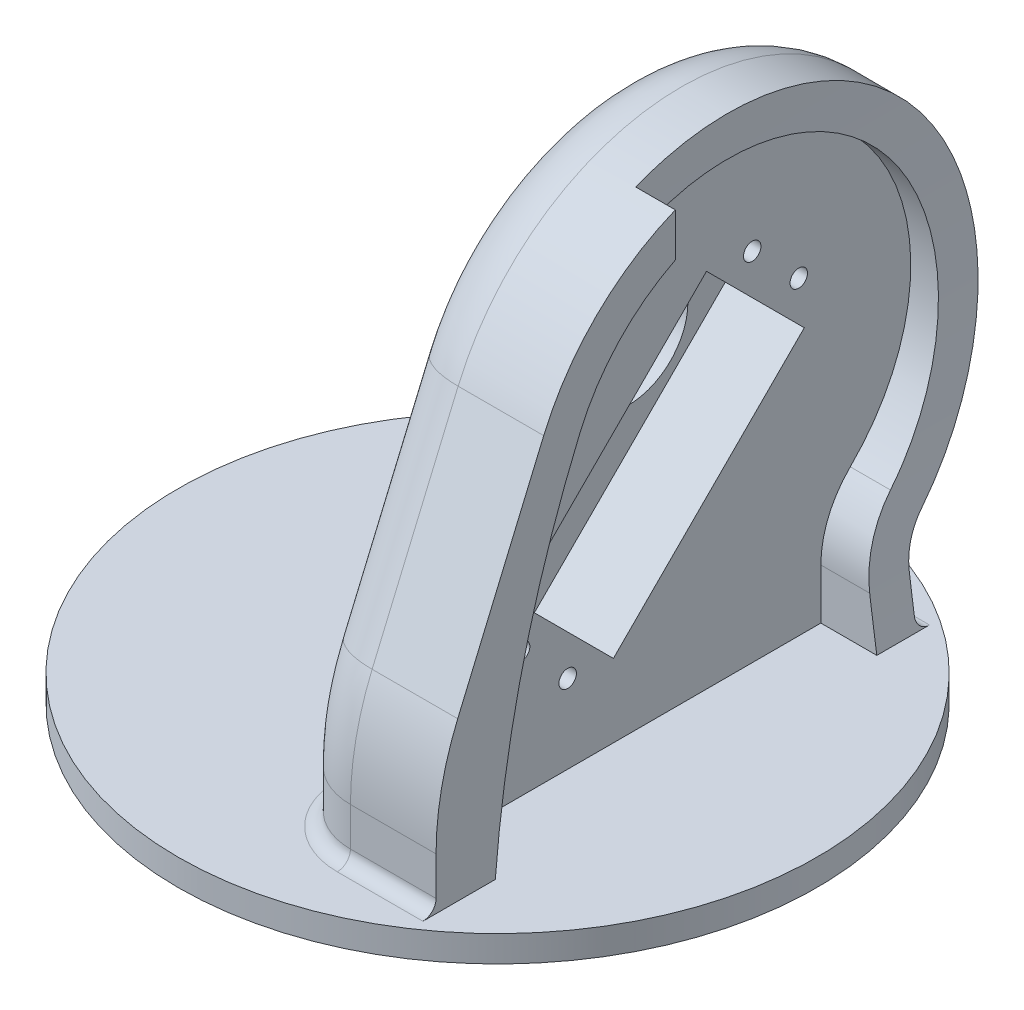
from build123d import *

# Parameters (mm, degrees)
SKETCH2_R                       = 48.5
SKETCH2_R_2                     = 1.5
BOSS_EXTRUDE1_DEPTH             = 4
SKETCH3_R                       = 3.75
CUT_EXTRUDE1_DEPTH              = 1.5
BOSS_EXTRUDE2_START             = 4
SKETCH4_R                       = 9
BOSS_EXTRUDE2_DEPTH             = 14
CUT_EXTRUDE2_START              = 6
SKETCH6_R                       = 1.325
CUT_EXTRUDE2_DEPTH              = 93.806192047
BOSS_EXTRUDE3_DEPTH             = 9
BOSS_EXTRUDE3_DIRECTION_2_REACH = 110.778
CUT_EXTRUDE3_DEPTH              = 105.285680763
FILLET1_R                       = 10
FILLET2_R                       = 2


with BuildPart() as part:
    # Sketch2 → Boss-Extrude1 (new body)
    with BuildSketch(Plane(origin=(0, 0, 0), x_dir=(1, 0, 0), z_dir=(0, 1, 0))):
        with Locations(Location((0, 0, 0), (0, 0, 270))):
            Circle(SKETCH2_R)
        with Locations(Location((0, 7.25, 0), (0, 0, 270))):
            Circle(SKETCH2_R_2, mode=Mode.SUBTRACT)
        with Locations(Location((0, -7.25, 0), (0, 0, 270))):
            Circle(SKETCH2_R_2, mode=Mode.SUBTRACT)
    extrude(amount=-BOSS_EXTRUDE1_DEPTH)

    # Sketch3 → Cut-Extrude1 (cut)
    with BuildSketch(Plane(origin=(0, -4, 0), x_dir=(-1, 0, 0), z_dir=(0, -1, 0))):
        with Locations(Location((0, 0, 0), (0, 0, 90))):
            Circle(SKETCH3_R)
    extrude(amount=-CUT_EXTRUDE1_DEPTH, mode=Mode.SUBTRACT)

    # Sketch4 → Boss-Extrude2 (add)
    with BuildSketch(Plane(origin=(0, 0, 0), x_dir=(0, 0, -1), z_dir=(1, 0, 0)).offset(BOSS_EXTRUDE2_START)):
        with BuildLine():
            Line((-14.470153899, 52.351446146), (-27.529193782, 21.649444314))
            ThreePointArc((-27.529193782, 21.649444314), (-29.630146994, 14.89650137), (-30.34, 7.86))
            Line((-30.34, 7.86), (-30.34, 0))
            Line((-30.34, 0), (31.097052925, 0))
            Line((31.097052925, 0), (31.097052925, 7.64))
            ThreePointArc((31.097052925, 7.64), (32.258997722, 13.428629218), (35.564816687, 18.320449421))
            ThreePointArc((35.564816687, 18.320449421), (31.254587763, 65.781337665), (-14.470153899, 52.351446146))
        make_face()
        with Locations((13.91, 40.28)):
            Circle(SKETCH4_R, mode=Mode.SUBTRACT)
    extrude(amount=BOSS_EXTRUDE2_DEPTH)

    # Sketch6 → Cut-Extrude2 (cut, through all)
    with BuildSketch(Plane(origin=(0, 0, 0), x_dir=(0, 0, -1), z_dir=(1, 0, 0)).offset(CUT_EXTRUDE2_START)):
        with Locations(Location((20.674280786, 54.114591003, 0), (0, 0, 180))):
            Circle(SKETCH6_R)
        with Locations(Location((27.745348598, 47.043523191, 0), (0, 0, 180))):
            Circle(SKETCH6_R)
        with Locations(Location((-7.352145163, 11.94602943, 0), (0, 0, 180))):
            Circle(SKETCH6_R)
        with Locations(Location((-14.423212974, 19.017097242, 0), (0, 0, 180))):
            Circle(SKETCH6_R)
        Polygon((-0.41, 11.11), (-15.259242405, 25.959242405), (13.732135624, 54.950620434), (28.581378029, 40.101378029), align=None)
    extrude(amount=CUT_EXTRUDE2_DEPTH, mode=Mode.SUBTRACT)

    # Sketch8 → Boss-Extrude3 (add)
    with BuildSketch(Plane(origin=(18, 0, 0), x_dir=(0, 0, -1), z_dir=(1, 0, 0))):
        with BuildLine():
            Line((37.097052925, 0), (37.097052925, 7.64))
            ThreePointArc((37.097052925, 7.64), (37.794219803, 11.113177531), (39.777711182, 14.048269653))
            ThreePointArc((39.777711182, 14.048269653), (34.628937191, 70.742563919), (-19.991447191, 54.69991807))
            Line((-19.991447191, 54.69991807), (-33.050487075, 23.997916239))
            ThreePointArc((-33.050487075, 23.997916239), (-35.509252358, 16.094883664), (-36.34, 7.86))
            Line((-36.34, 7.86), (-36.34, 0))
            Line((-36.34, 0), (-27.34, 0))
            ThreePointArc((-27.34, 0), (-23.018237165, 26.695212958), (-14.470153899, 52.351446146))
            ThreePointArc((-14.470153899, 52.351446146), (31.254587763, 65.781337665), (35.564816687, 18.320449421))
            ThreePointArc((35.564816687, 18.320449421), (32.258997722, 13.428629218), (31.097052925, 7.64))
            Line((31.097052925, 7.64), (31.097052925, 0))
            Line((31.097052925, 0), (37.097052925, 0))
        make_face()
    extrude(amount=BOSS_EXTRUDE3_DEPTH)

    # Boss-Extrude3 direction 2: up to this face of the body (flat: up to its plane)
    boss_extrude3_direction_2_end = Plane(part.part.faces().sort_by_distance((4, 32.037892767, -8.057594293))[0])
    # Sketch8 → Boss-Extrude3 direction 2 (add, up to the picked face)
    with BuildSketch(Plane(origin=(18, 0, 0), x_dir=(0, 0, -1), z_dir=(1, 0, 0)), mode=Mode.PRIVATE) as boss_extrude3_direction_2_sk1:
        with BuildLine():
            Line((37.097052925, 0), (37.097052925, 7.64))
            ThreePointArc((37.097052925, 7.64), (37.794219803, 11.113177531), (39.777711182, 14.048269653))
            ThreePointArc((39.777711182, 14.048269653), (34.628937191, 70.742563919), (-19.991447191, 54.69991807))
            Line((-19.991447191, 54.69991807), (-33.050487075, 23.997916239))
            ThreePointArc((-33.050487075, 23.997916239), (-35.509252358, 16.094883664), (-36.34, 7.86))
            Line((-36.34, 7.86), (-36.34, 0))
            Line((-36.34, 0), (-27.34, 0))
            ThreePointArc((-27.34, 0), (-23.018237165, 26.695212958), (-14.470153899, 52.351446146))
            ThreePointArc((-14.470153899, 52.351446146), (31.254587763, 65.781337665), (35.564816687, 18.320449421))
            ThreePointArc((35.564816687, 18.320449421), (32.258997722, 13.428629218), (31.097052925, 7.64))
            Line((31.097052925, 7.64), (31.097052925, 0))
            Line((31.097052925, 0), (37.097052925, 0))
        make_face()
    boss_extrude3_direction_2_tool1 = split(extrude(boss_extrude3_direction_2_sk1.sketch, amount=-BOSS_EXTRUDE3_DIRECTION_2_REACH, mode=Mode.PRIVATE), bisect_by=boss_extrude3_direction_2_end, keep=Keep.BOTH, mode=Mode.PRIVATE)
    add(boss_extrude3_direction_2_tool1.solids().sort_by(Axis((18, 66.743228, -31.908812), (-1, 0, 0)))[0])

    # Sketch9 → Cut-Extrude3 (cut, through all)
    with BuildSketch(Plane.XY):
        with BuildLine():
            Line((27, 77.12076762), (21, 77.12076762))
            ThreePointArc((21, 77.12076762), (22.257085893, 38.453914076), (26.5, 0))
            Line((26.5, 0), (27, 0))
            Line((27, 0), (27, 77.12076762))
        make_face()
    extrude(amount=-CUT_EXTRUDE3_DEPTH, mode=Mode.SUBTRACT)

    # Fillet1
    fillet1_edges = [part.edges().sort_by_distance(p)[0] for p in [
        (4, 3.82, -37.097052925),
        (4, 11.113177531, -37.794219803),
        (4, 70.742563919, -34.628937191),
        (4, 39.348917154, 26.520967133),
        (4, 16.094883664, 35.509252358),
        (4, 3.93, 36.34),
    ]]
    fillet(fillet1_edges, radius=FILLET1_R)

    # Fillet2
    fillet2_edges = [part.edges().sort_by_distance(p)[0] for p in [
        (20.25, 0, -37.097052925),
        (4, 0, -0.378526462),
        (20.5, 0, 36.34),
        (6.928932188, 0, -34.168120736),
        (6.928932188, 0, 33.411067812),
    ]]
    fillet(fillet2_edges, radius=FILLET2_R)


solid = part.part
